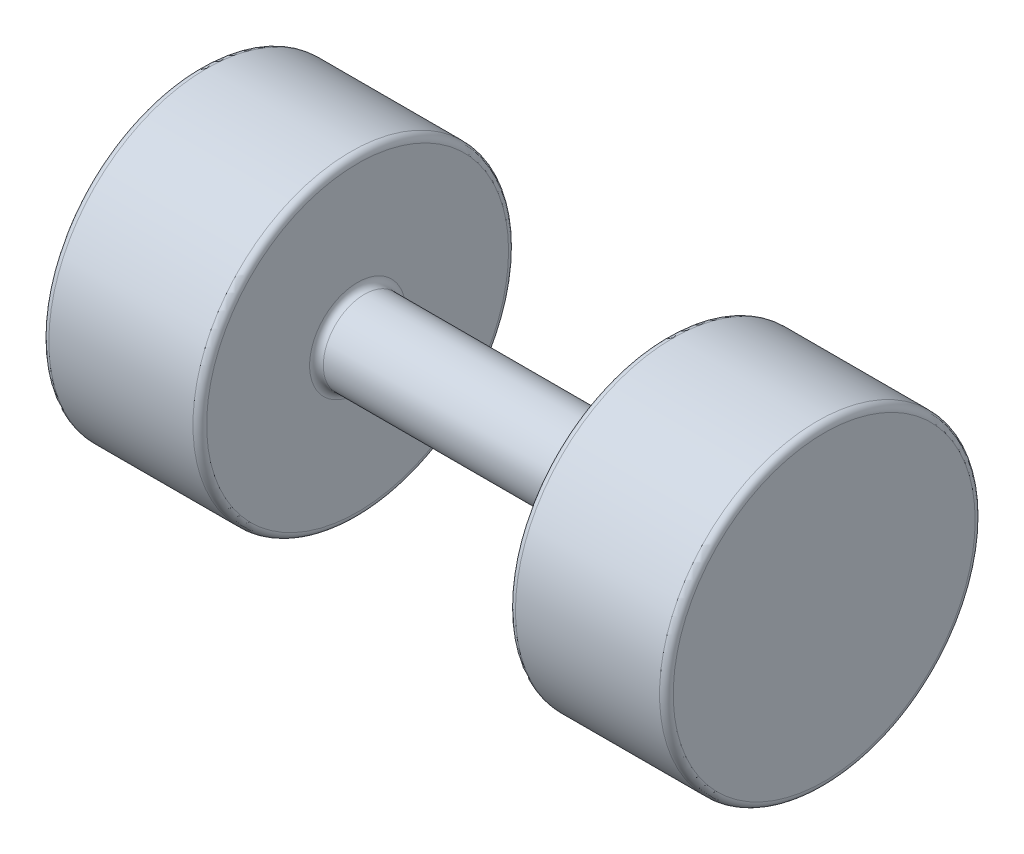
from build123d import *

# Parameters (mm, degrees)
FILLET1_R = 2


with BuildPart() as part:
    # Sketch1 → Revolve1 (revolve)
    with BuildSketch(Plane.XY, mode=Mode.PRIVATE) as revolve1_sk:
        Polygon((91, 0), (-91, 0), (-91, 46), (-45, 46), (-45, 12), (45, 12), (45, 46), (91, 46), align=None)
    revolve(revolve1_sk.sketch.rotate(Axis((91, 0, 0), (-1, 0, 0)), 90), axis=Axis((91, 0, 0), (-1, 0, 0)))

    # Fillet1
    fillet1_edges = [part.edges().sort_by_distance(p)[0] for p in [
        (-91, 0, 46),
        (-45, 0, 46),
        (-45, 0, 12),
        (45, 0, 12),
        (45, 0, 46),
        (91, 0, 46),
    ]]
    fillet(fillet1_edges, radius=FILLET1_R)


solid = part.part
